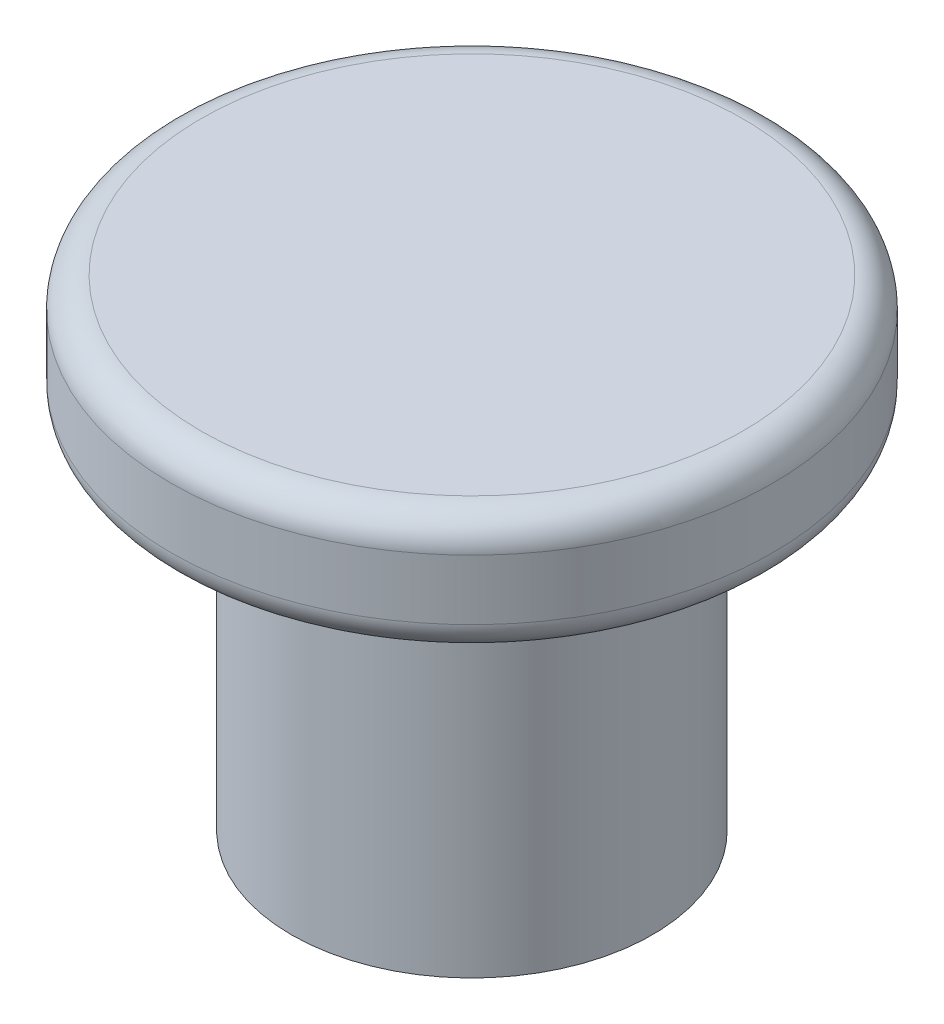
from build123d import *

# Parameters (mm, degrees)
SKETCH1_R                              = 2.5
BOSS_EXTRUDE1_DEPTH                    = 1
FILLET1_R                              = 0.25
SKETCH2_R                              = 1.5
BOSS_EXTRUDE2_DEPTH                    = 3
F_1_16_0_07874016_DIAMETER_HOLE1_D     = 2.000000064
F_1_16_0_07874016_DIAMETER_HOLE1_DEPTH = 1.75
F_1_16_0_07874016_DIAMETER_HOLE1_TIP   = 0.600860638
FILLET2_R                              = 0.15


with BuildPart() as part:
    # Sketch1 → Boss-Extrude1 (new body)
    with BuildSketch(Plane(origin=(0, 0, 0), x_dir=(1, 0, 0), z_dir=(0, 1, 0))):
        with Locations(Location((0, 0, 0), (0, 0, 270))):
            Circle(SKETCH1_R)
    extrude(amount=BOSS_EXTRUDE1_DEPTH)

    # Fillet1
    fillet1_edges = [part.edges().sort_by_distance(p)[0] for p in [
        (0, 0, -2.5),
        (0, 1, -2.5),
    ]]
    fillet(fillet1_edges, radius=FILLET1_R)

    # Sketch2 → Boss-Extrude2 (add)
    with BuildSketch(Plane.XZ):
        with Locations(Location((0, 0, 0), (0, 0, 90))):
            Circle(SKETCH2_R)
    extrude(amount=BOSS_EXTRUDE2_DEPTH)

    # 1/16 (0.07874016) Diameter Hole1
    with Locations(Plane(origin=(0, -3, 0), x_dir=(-1, 0, 0), z_dir=(0, -1, 0))):
        with Locations((0, 0)):
            Hole(F_1_16_0_07874016_DIAMETER_HOLE1_D / 2, depth=F_1_16_0_07874016_DIAMETER_HOLE1_DEPTH)
            with Locations((0, 0, -(F_1_16_0_07874016_DIAMETER_HOLE1_DEPTH + F_1_16_0_07874016_DIAMETER_HOLE1_TIP / 2))):  # 118° drill point
                Cone(0, F_1_16_0_07874016_DIAMETER_HOLE1_D / 2, F_1_16_0_07874016_DIAMETER_HOLE1_TIP, mode=Mode.SUBTRACT)

    # Fillet2
    fillet2_edges = [part.edges().sort_by_distance(p)[0] for p in [
        (-1.000000032, -3, 0),
    ]]
    fillet(fillet2_edges, radius=FILLET2_R)


solid = part.part
